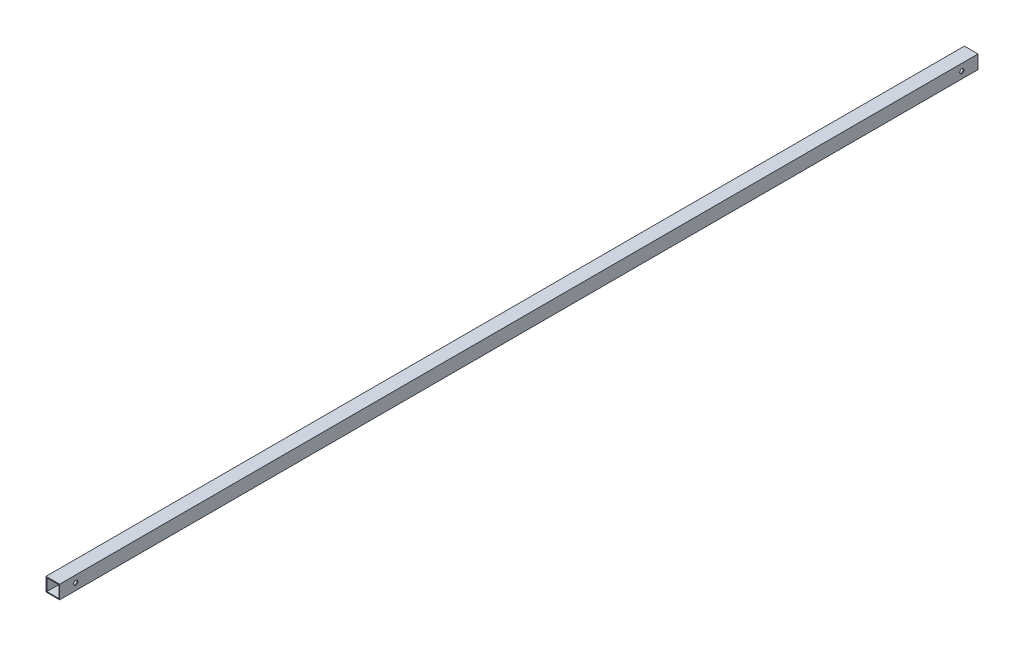
from build123d import *

# Parameters (mm, degrees)
CROQUIS1_W            = 16
CROQUIS1_H            = 16
CROQUIS1_W_2          = 14
CROQUIS1_H_2          = 14
EXTRUIR_L_MINA1_DEPTH = 540
CROQUIS2_R            = 2.5
EXTRUIR1_DEPTH        = 541.296215052


with BuildPart() as part:
    # Croquis1 → Extruir-Lámina1 (new, symmetric)
    with BuildSketch(Plane.XY):
        Rectangle(CROQUIS1_W, CROQUIS1_H)
        Rectangle(CROQUIS1_W_2, CROQUIS1_H_2, mode=Mode.SUBTRACT)
    extrude(amount=EXTRUIR_L_MINA1_DEPTH, both=True)

    # Croquis2 → Extruir1 (cut, through all)
    with BuildSketch(Plane(origin=(8, 0, 0), x_dir=(0, 0, -1), z_dir=(1, 0, 0))):
        with Locations((-521, 0)):
            Circle(CROQUIS2_R)
        with Locations(Location((521, 0, 0), (0, 0, 180))):
            Circle(CROQUIS2_R)
    extrude(amount=-EXTRUIR1_DEPTH, mode=Mode.SUBTRACT)


solid = part.part
